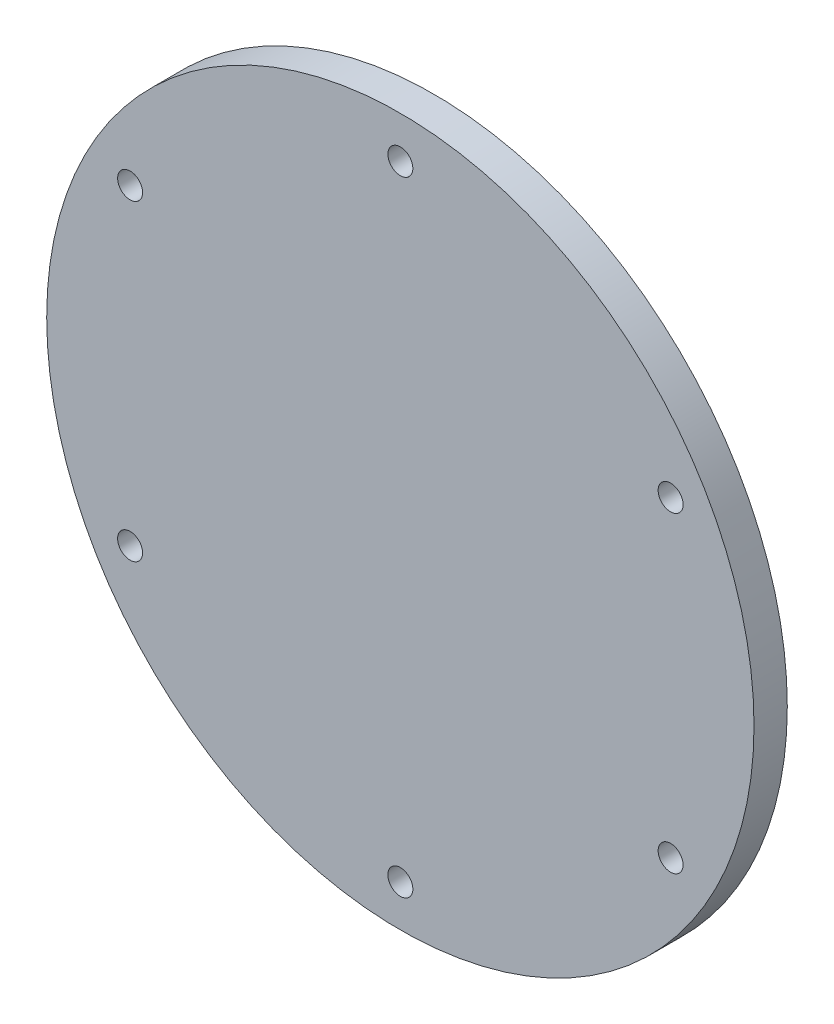
from build123d import *

# Parameters (mm, degrees)
SKETCH_1_R      = 85
SKETCH_1_R_2    = 3
EXTRUDE_1_DEPTH = 8


with BuildPart() as part:
    # 草图1 → 凸台-拉伸1 (new body)
    with BuildSketch(Plane.XY):
        Circle(SKETCH_1_R)
        with Locations((0, 75)):
            Circle(SKETCH_1_R_2, mode=Mode.SUBTRACT)
        with Locations((64.951905284, 37.5)):
            Circle(SKETCH_1_R_2, mode=Mode.SUBTRACT)
        with Locations((64.951905284, -37.5)):
            Circle(SKETCH_1_R_2, mode=Mode.SUBTRACT)
        with Locations((0, -75)):
            Circle(SKETCH_1_R_2, mode=Mode.SUBTRACT)
        with Locations((-64.951905284, -37.5)):
            Circle(SKETCH_1_R_2, mode=Mode.SUBTRACT)
        with Locations((-64.951905284, 37.5)):
            Circle(SKETCH_1_R_2, mode=Mode.SUBTRACT)
    extrude(amount=EXTRUDE_1_DEPTH)


solid = part.part
